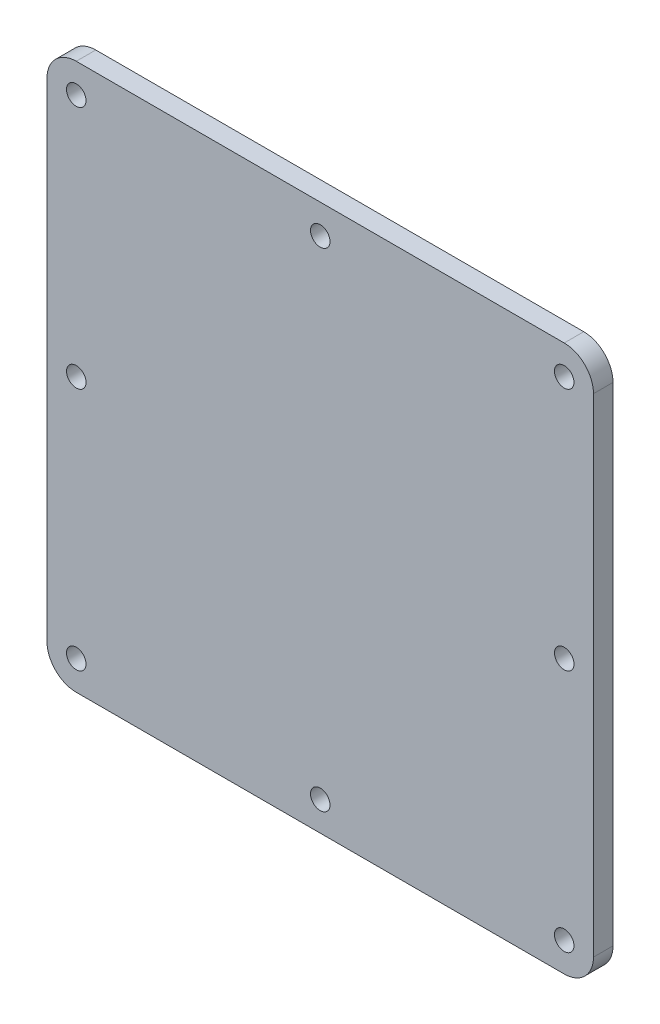
from build123d import *

# Parameters (mm, degrees)
SKETCH2_R           = 5
BOSS_EXTRUDE1_DEPTH = 10


with BuildPart() as part:
    # Sketch2 → Boss-Extrude1 (new body)
    with BuildSketch(Plane.XY):
        with BuildLine():
            Line((-125, 140), (125, 140))
            ThreePointArc((125, 140), (135.606601718, 135.606601718), (140, 125))
            Line((140, 125), (140, -125))
            ThreePointArc((140, -125), (135.606601718, -135.606601718), (125, -140))
            Line((125, -140), (-125, -140))
            ThreePointArc((-125, -140), (-135.606601718, -135.606601718), (-140, -125))
            Line((-140, -125), (-140, 125))
            ThreePointArc((-140, 125), (-135.606601718, 135.606601718), (-125, 140))
        make_face()
        with Locations((-125, 125)):
            Circle(SKETCH2_R, mode=Mode.SUBTRACT)
        with Locations((0, 125)):
            Circle(SKETCH2_R, mode=Mode.SUBTRACT)
        with Locations((125, 125)):
            Circle(SKETCH2_R, mode=Mode.SUBTRACT)
        with Locations((125, 0)):
            Circle(SKETCH2_R, mode=Mode.SUBTRACT)
        with Locations((-125, 0)):
            Circle(SKETCH2_R, mode=Mode.SUBTRACT)
        with Locations((-125, -125)):
            Circle(SKETCH2_R, mode=Mode.SUBTRACT)
        with Locations((0, -125)):
            Circle(SKETCH2_R, mode=Mode.SUBTRACT)
        with Locations((125, -125)):
            Circle(SKETCH2_R, mode=Mode.SUBTRACT)
    extrude(amount=BOSS_EXTRUDE1_DEPTH)


solid = part.part
